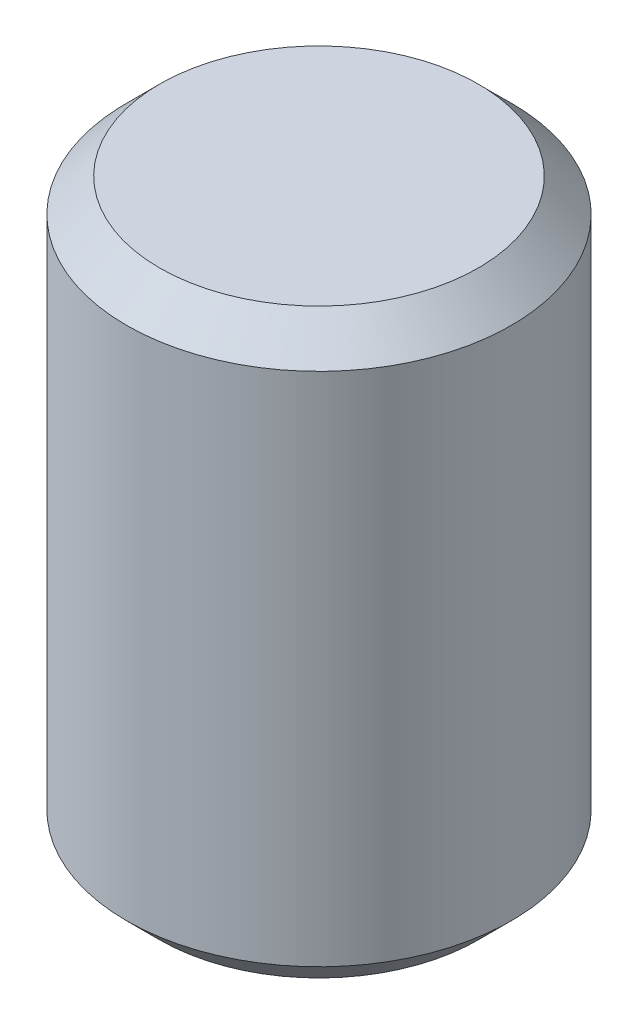
from build123d import *

# Parameters (mm, degrees)
SKETCH2_R           = 1.1811
BOSS_EXTRUDE1_DEPTH = 3.57124
FILLET1_SIZE        = 0.2032


with BuildPart() as part:
    # Sketch2 → Boss-Extrude1 (new body)
    with BuildSketch(Plane(origin=(0, 0, 0), x_dir=(1, 0, 0), z_dir=(0, 1, 0))):
        with Locations(Location((0, 0, 0), (0, 0, 270))):
            Circle(SKETCH2_R)
    extrude(amount=BOSS_EXTRUDE1_DEPTH)

    # Fillet1
    fillet1_edges = [part.edges().sort_by_distance(p)[0] for p in [
        (0, 0, -1.1811),
        (0, 3.57124, -1.1811),
    ]]
    chamfer(fillet1_edges, length=FILLET1_SIZE)


solid = part.part
